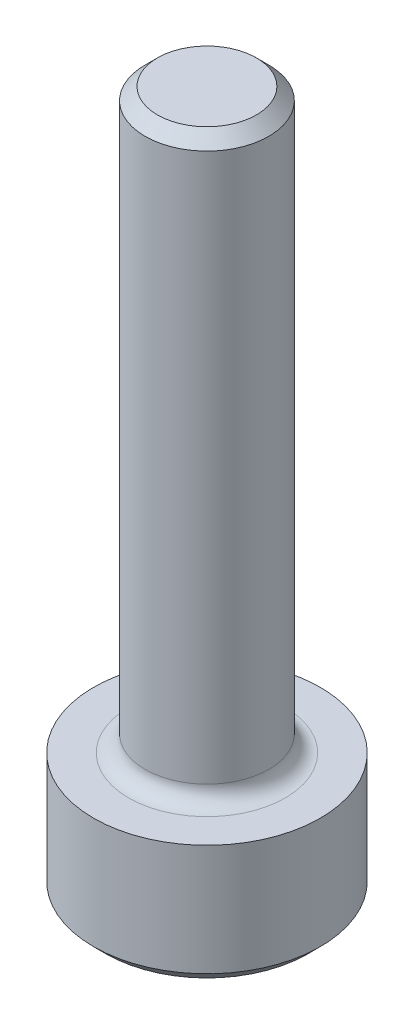
from build123d import *

# Parameters (mm, degrees)
SKETCH2_R           = 1.5
BOSS_EXTRUDE1_DEPTH = 14
SKETCH3_R           = 2.75
BOSS_EXTRUDE2_DEPTH = 3
FILLET1_R           = 0.4
CHAMFER1_SIZE       = 0.3
CUT_EXTRUDE1_DEPTH  = 2.5


with BuildPart() as part:
    # Sketch2 → Boss-Extrude1 (new body)
    with BuildSketch(Plane(origin=(0, 0, 0), x_dir=(1, 0, 0), z_dir=(0, 1, 0))):
        with Locations(Location((0, 0, 0), (0, 0, 270))):
            Circle(SKETCH2_R)
    extrude(amount=BOSS_EXTRUDE1_DEPTH)

    # Sketch3 → Boss-Extrude2 (add)
    with BuildSketch(Plane(origin=(0, 0, 0), x_dir=(1, 0, 0), z_dir=(0, 1, 0))):
        with Locations(Location((0, 0, 0), (0, 0, 270))):
            Circle(SKETCH3_R)
    extrude(amount=-BOSS_EXTRUDE2_DEPTH)

    # Fillet1
    fillet1_edges = [part.edges().sort_by_distance(p)[0] for p in [
        (0, 0, -1.5),
    ]]
    fillet(fillet1_edges, radius=FILLET1_R)

    # Chamfer1
    chamfer1_edges = [part.edges().sort_by_distance(p)[0] for p in [
        (0, 14, -1.5),
        (0, -3, -2.75),
    ]]
    chamfer(chamfer1_edges, length=CHAMFER1_SIZE)

    # Sketch4 → Cut-Extrude1 (cut)
    with BuildSketch(Plane.XZ.offset(3)):
        Polygon((0, 1.443375673), (-1.25, 0.721687836), (-1.25, -0.721687836), (0, -1.443375673), (1.25, -0.721687836), (1.25, 0.721687836), align=None)
    extrude(amount=-CUT_EXTRUDE1_DEPTH, mode=Mode.SUBTRACT)


solid = part.part
